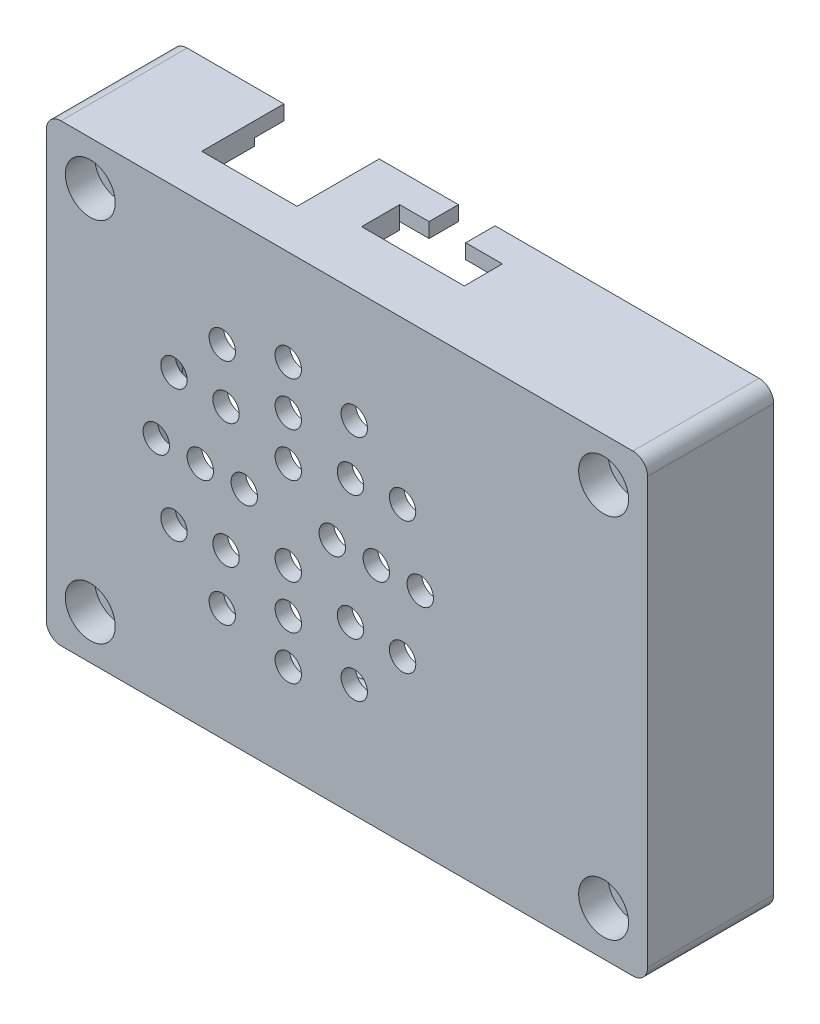
from build123d import *

# Parameters (mm, degrees)
SKETCH_1_W           = 41
SKETCH_1_H           = 31
SKETCH_1_W_2         = 31
SKETCH_1_H_2         = 21
EXTRUDE_1_DEPTH      = 5
SKETCH_2_W           = 41
SKETCH_2_H           = 31
EXTRUDE_1_2_DEPTH    = 2
CUT_EXTRUDE_START    = -7
SKETCH_3_R           = 1.7
CUT_EXTRUDE_1_DEPTH  = 2
SKETCH_4_R           = 0.7
CUT_EXTRUDE_2_DEPTH  = 27.182054923
FILLET_1_R           = 1
CUT_EXTRUDE_3_DEPTH  = 5
CUT_EXTRUDE_5_DEPTH  = 1
EXTRUDE_START        = 1
EXTRUDE_2_DEPTH      = 1
SKETCH_12_W          = 31
SKETCH_12_H          = 0.5
SKETCH_12_W_2        = 0.5
SKETCH_12_H_2        = 21
CUT_EXTRUDE_9_DEPTH  = 4
EXTRUDE_3_DEPTH      = 1.6
SKETCH_18_W          = 31
SKETCH_18_H          = 0.5
EXTRUDE_4_DEPTH      = 3.6
SKETCH_14_W          = 6.5
SKETCH_14_H          = 6
CUT_EXTRUDE_10_DEPTH = 2
SKETCH_16_R          = 0.9
CUT_EXTRUDE_12_DEPTH = 10
SKETCH_17_W          = 2
SKETCH_17_H          = 1.850967132
CUT_EXTRUDE_13_DEPTH = 2
SKETCH_19_W          = 0.5
SKETCH_19_H          = 21
CUT_EXTRUDE_14_DEPTH = 2
EXTRUDE_5_DEPTH      = 2


with BuildPart() as part:
    # 草图1 → Extrude 1 (new body)
    with BuildSketch(Plane.XY):
        Rectangle(SKETCH_1_W, SKETCH_1_H)
        Rectangle(SKETCH_1_W_2, SKETCH_1_H_2, mode=Mode.SUBTRACT)
    extrude(amount=EXTRUDE_1_DEPTH)

    # 草图2 → Extrude 1 2 (add)
    with BuildSketch(Plane.XY.offset(5)):
        Rectangle(SKETCH_2_W, SKETCH_2_H)
    extrude(amount=EXTRUDE_1_2_DEPTH)

    # 草图3 → 切除-拉伸1 (cut)
    with BuildSketch(Plane(origin=(0, 0, 0), x_dir=(-1, 0, 0), z_dir=(0, 0, -1)).offset(CUT_EXTRUDE_START)):
        with Locations(Location((17.5, 12.5, 0), (0, 0, 180))):
            Circle(SKETCH_3_R)
        with Locations(Location((-17.5, 12.5, 0), (0, 0, 180))):
            Circle(SKETCH_3_R)
        with Locations(Location((17.5, -12.5, 0), (0, 0, 180))):
            Circle(SKETCH_3_R)
        with Locations(Location((-17.5, -12.5, 0), (0, 0, 180))):
            Circle(SKETCH_3_R)
    extrude(amount=CUT_EXTRUDE_1_DEPTH, mode=Mode.SUBTRACT)

    # 草图4 → 切除-拉伸2 (cut, through all)
    with BuildSketch(Plane.XY.offset(5)):
        with Locations((17.5, 12.5)):
            Circle(SKETCH_4_R)
        with Locations(Location((-17.5, 12.5, 0), (0, 0, 180))):
            Circle(SKETCH_4_R)
        with Locations(Location((17.5, -12.5, 0), (0, 0, 180))):
            Circle(SKETCH_4_R)
        with Locations((-17.5, -12.5)):
            Circle(SKETCH_4_R)
    extrude(amount=-CUT_EXTRUDE_2_DEPTH, mode=Mode.SUBTRACT)

    # 圆角1
    fillet_1_edges = [part.edges().sort_by_distance(p)[0] for p in [
        (20.5, -15.5, 3.5),
        (-20.5, -15.5, 3.5),
        (-20.5, 15.5, 3.5),
        (20.5, 15.5, 3.5),
    ]]
    fillet(fillet_1_edges, radius=FILLET_1_R)

    # 草图5 → 切除-拉伸3 (cut)
    with BuildSketch(Plane(origin=(0, 0, 0), x_dir=(-1, 0, 0), z_dir=(0, 0, -1))):
        Polygon((-15.5, 10.5), (-15.5, 12.5), (-15.5, 13.995698298), (15.5, 13.995698298), (15.5, 12.5), (15.5, 10.5), (17.5, 10.5), (19, 10.5), (19, -10.5), (17.5, -10.5), (15.5, -10.5), (15.5, -12.5), (15.5, -14), (-15.5, -14), (-15.5, -12.5), (-15.5, -10.5), (-17.5, -10.5), (-19, -10.5), (-19, 10.5), (-17.5, 10.5), align=None)
    extrude(amount=-CUT_EXTRUDE_3_DEPTH, mode=Mode.SUBTRACT)

    # 草图7 → 切除-拉伸5 (cut)
    with BuildSketch(Plane(origin=(0, 0, 5), x_dir=(-1, 0, 0), z_dir=(0, 0, -1))):
        Polygon((-15.5, 13.995698298), (15.5, 13.995698298), (15.5, 10.5), (19, 10.5), (19, -10.5), (15.5, -10.5), (15.5, -14), (-15.5, -14), (-15.5, -10.5), (-19, -10.5), (-19, -8.940076883), (-19, 8.940076883), (-19, 10.5), (-15.5, 10.5), align=None)
        with BuildLine():
            Line((-8, 8.940076883), (-8, -8.940076883))
            Line((-8, -8.940076883), (-3.073544042, -8.940076883))
            ThreePointArc((-3.073544042, -8.940076883), (12.960986832, -7.047035902), (11.02046595, 8.981818182))
            Line((11.02046595, 8.981818182), (9.242799076, 8.981818182))
            ThreePointArc((9.242799076, 8.981818182), (4.041122306, -10.399918699), (-1.31366402, 8.940076883))
            Line((-1.31366402, 8.940076883), (-4.642515442, 8.940076883))
            Line((-4.642515442, 8.940076883), (-8, 8.940076883))
        make_face(mode=Mode.SUBTRACT)
    extrude(amount=-CUT_EXTRUDE_5_DEPTH, mode=Mode.SUBTRACT)

    # 草图9 → 凸台-拉伸2 (add)
    with BuildSketch(Plane(origin=(0, 0, 5), x_dir=(-1, 0, 0), z_dir=(0, 0, -1)).offset(EXTRUDE_START)):
        with BuildLine():
            Line((-8, 8.940076883), (-1.31366402, 8.940076883))
            ThreePointArc((-1.31366402, 8.940076883), (4, -10.4), (9.31366402, 8.940076883))
            Line((9.31366402, 8.940076883), (11.073544042, 8.940076883))
            ThreePointArc((11.073544042, 8.940076883), (12.940076883, -7.073544042), (-3.073544042, -8.940076883))
            Line((-3.073544042, -8.940076883), (-8, -8.940076883))
            Line((-8, -8.940076883), (-8, 8.940076883))
        make_face()
    extrude(amount=-EXTRUDE_2_DEPTH)

    # 草图12 → 切除-拉伸9 (cut)
    with BuildSketch(Plane(origin=(0, 0, 0), x_dir=(-1, 0, 0), z_dir=(0, 0, -1))):
        with Locations((0, -14.25)):
            Rectangle(SKETCH_12_W, SKETCH_12_H)
        with Locations((0, 14.245698298)):
            Rectangle(SKETCH_12_W, SKETCH_12_H)
        with Locations((-19.25, 0)):
            Rectangle(SKETCH_12_W_2, SKETCH_12_H_2)
        with Locations((19.25, 0)):
            Rectangle(SKETCH_12_W_2, SKETCH_12_H_2)
    extrude(amount=-CUT_EXTRUDE_9_DEPTH, mode=Mode.SUBTRACT)

    # 草图13 → 凸台-拉伸3 (add)
    with BuildSketch(Plane(origin=(0, 0, 0), x_dir=(-1, 0, 0), z_dir=(0, 0, -1))):
        with BuildLine():
            Line((-19.5, 15.5), (19.5, 15.5))
            ThreePointArc((19.5, 15.5), (20.207106781, 15.207106781), (20.5, 14.5))
            Line((20.5, 14.5), (20.5, -14.5))
            ThreePointArc((20.5, -14.5), (20.207106781, -15.207106781), (19.5, -15.5))
            Line((19.5, -15.5), (-19.5, -15.5))
            ThreePointArc((-19.5, -15.5), (-20.207106781, -15.207106781), (-20.5, -14.5))
            Line((-20.5, -14.5), (-20.5, 14.5))
            ThreePointArc((-20.5, 14.5), (-20.207106781, 15.207106781), (-19.5, 15.5))
        make_face()
        with BuildLine():
            Line((-19.5, 13.495698298), (-19.5, -13.5))
            ThreePointArc((-19.5, -13.5), (-19.207106781, -14.207106781), (-18.5, -14.5))
            Line((-18.5, -14.5), (18.5, -14.5))
            ThreePointArc((18.5, -14.5), (19.207106781, -14.207106781), (19.5, -13.5))
            Line((19.5, -13.5), (19.5, 13.495698298))
            ThreePointArc((19.5, 13.495698298), (19.207106781, 14.20280508), (18.5, 14.495698298))
            Line((18.5, 14.495698298), (-18.5, 14.495698298))
            ThreePointArc((-18.5, 14.495698298), (-19.207106781, 14.20280508), (-19.5, 13.495698298))
        make_face(mode=Mode.SUBTRACT)
    extrude(amount=EXTRUDE_3_DEPTH)

    # 草图18 → 凸台-拉伸4 (add)
    with BuildSketch(Plane(origin=(0, 0, 4), x_dir=(-1, 0, 0), z_dir=(0, 0, -1))):
        with Locations((0, 14.245698298)):
            Rectangle(SKETCH_18_W, SKETCH_18_H)
    extrude(amount=EXTRUDE_4_DEPTH)

    # 草图14 → 切除-拉伸10 (cut)
    with BuildSketch(Plane(origin=(0, 15.5, 0), x_dir=(1, 0, 0), z_dir=(0, 1, 0))):
        Polygon((-1, 1.6), (-1, -0.4), (-3, -0.4), (-3, -3), (4, -3), (4, -0.4), (1.5, -0.4), (1.5, 1.6), align=None)
        with Locations((-9.65, -1)):
            Rectangle(SKETCH_14_W, SKETCH_14_H)
    extrude(amount=-CUT_EXTRUDE_10_DEPTH, mode=Mode.SUBTRACT)

    # 草图16 → 切除-拉伸12 (cut)
    with BuildSketch(Plane(origin=(0, 0, 6), x_dir=(-1, 0, 0), z_dir=(0, 0, -1))):
        with Locations((4, 3)):
            Circle(SKETCH_16_R)
        with Locations((7, 0)):
            Circle(SKETCH_16_R)
        with Locations((4, -3)):
            Circle(SKETCH_16_R)
        with Locations((1, 0)):
            Circle(SKETCH_16_R)
        with Locations((4, 6)):
            Circle(SKETCH_16_R)
        with Locations((4, 9)):
            Circle(SKETCH_16_R)
        with Locations((8.5, 7.794228634)):
            Circle(SKETCH_16_R)
        with Locations((11.794228634, 4.5)):
            Circle(SKETCH_16_R)
        with Locations((13, 0)):
            Circle(SKETCH_16_R)
        with Locations((11.794228634, -4.5)):
            Circle(SKETCH_16_R)
        with Locations((8.5, -7.794228634)):
            Circle(SKETCH_16_R)
        with Locations((4, -9)):
            Circle(SKETCH_16_R)
        with Locations((-0.5, -7.794228634)):
            Circle(SKETCH_16_R)
        with Locations((-3.794228634, -4.5)):
            Circle(SKETCH_16_R)
        with Locations((-5, 0)):
            Circle(SKETCH_16_R)
        with Locations((-3.794228634, 4.5)):
            Circle(SKETCH_16_R)
        with Locations((-0.5, 7.794228634)):
            Circle(SKETCH_16_R)
        with Locations((8.242640687, 4.242640687)):
            Circle(SKETCH_16_R)
        with Locations((10, 0)):
            Circle(SKETCH_16_R)
        with Locations((8.242640687, -4.242640687)):
            Circle(SKETCH_16_R)
        with Locations((4, -6)):
            Circle(SKETCH_16_R)
        with Locations((-0.242640687, -4.242640687)):
            Circle(SKETCH_16_R)
        with Locations((-2, 0)):
            Circle(SKETCH_16_R)
        with Locations((-0.242640687, 4.242640687)):
            Circle(SKETCH_16_R)
    extrude(amount=-CUT_EXTRUDE_12_DEPTH, mode=Mode.SUBTRACT)

    # 草图17 → 切除-拉伸13 (cut)
    with BuildSketch(Plane(origin=(0, 0, 4), x_dir=(-1, 0, 0), z_dir=(0, 0, -1))):
        with Locations((-2.31366402, 8.014593317)):
            Rectangle(SKETCH_17_W, SKETCH_17_H)
        Polygon((9.242799076, 8.981818182), (11.242799076, 8.981818182), (10.275574211, 8.014593317), align=None)
    extrude(amount=-CUT_EXTRUDE_13_DEPTH, mode=Mode.SUBTRACT)

    # 草图19 → 切除-拉伸14 (cut)
    with BuildSketch(Plane(origin=(0, 0, 4), x_dir=(-1, 0, 0), z_dir=(0, 0, -1))):
        with Locations((-19.25, 0)):
            Rectangle(SKETCH_19_W, SKETCH_19_H)
    extrude(amount=-CUT_EXTRUDE_14_DEPTH, mode=Mode.SUBTRACT)

    # 草图20 → 凸台-拉伸5 (add)
    with BuildSketch(Plane(origin=(0, 0, 4), x_dir=(-1, 0, 0), z_dir=(0, 0, -1))):
        with BuildLine():
            ThreePointArc((8, -10.675204916), (4, -11.4), (0, -10.675204916))
            Line((0, -10.675204916), (0, -14))
            Line((0, -14), (4, -14))
            Line((4, -14), (8, -14))
            Line((8, -14), (8, -10.675204916))
        make_face()
        with BuildLine():
            Line((19, -4), (19, 0))
            Line((19, 0), (19, 4))
            Line((19, 4), (14.675204916, 4))
            ThreePointArc((14.675204916, 4), (15.217337831, 2.032567829), (15.4, 0))
            ThreePointArc((15.4, 0), (15.217337831, -2.032567829), (14.675204916, -4))
            Line((14.675204916, -4), (19, -4))
        make_face()
    extrude(amount=-EXTRUDE_5_DEPTH)


solid = part.part
